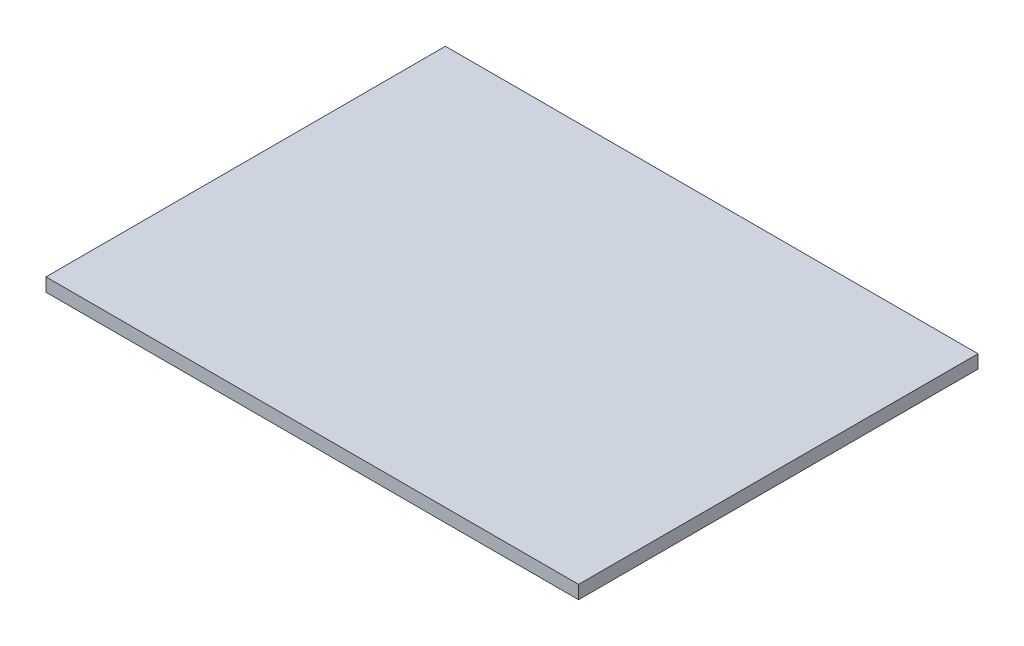
from build123d import *

# Parameters (mm, degrees)
CROQUIS1_W              = 40
CROQUIS1_H              = 30
SALIENTE_EXTRUIR1_DEPTH = 1


with BuildPart() as part:
    # Croquis1 → Saliente-Extruir1 (new body)
    with BuildSketch(Plane(origin=(0, 0, 0), x_dir=(1, 0, 0), z_dir=(0, 1, 0))):
        Rectangle(CROQUIS1_W, CROQUIS1_H)
    extrude(amount=SALIENTE_EXTRUIR1_DEPTH)


solid = part.part
